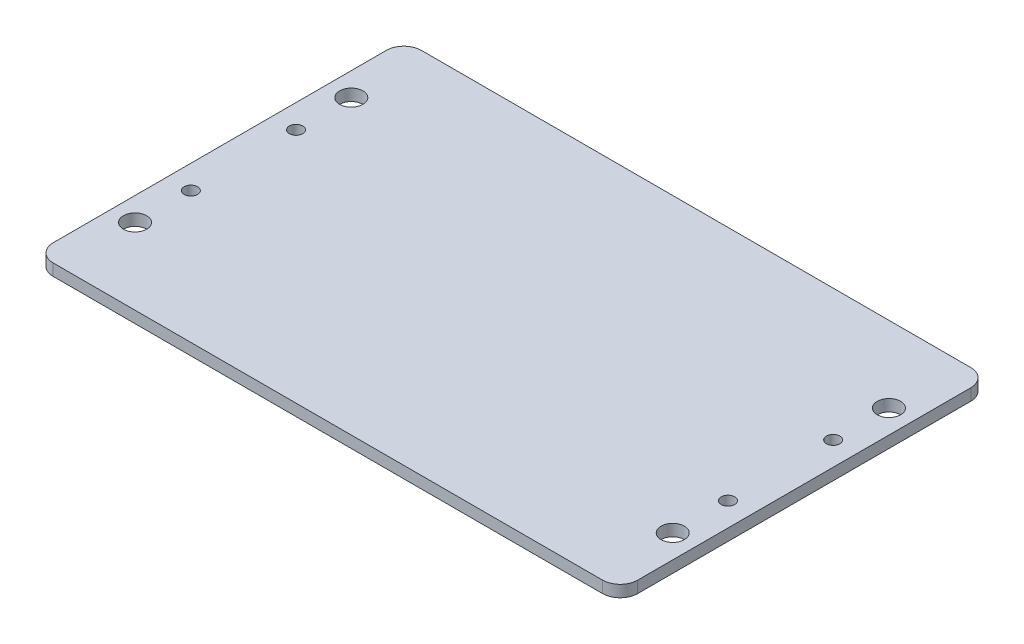
from build123d import *

# Parameters (mm, degrees)
ESBO_O1_W                = 100
ESBO_O1_H                = 63
RESSALTO_EXTRUS_O1_DEPTH = 2
ESBO_O5_R                = 2
CORTE_EXTRUS_O3_DEPTH    = 60.129096053
FILETE1_R                = 3
ESBO_O6_R                = 1.15
CORTE_EXTRUS_O4_DEPTH    = 60.129096053


with BuildPart() as part:
    # Esboço1 → Ressalto-extrusão1 (new body)
    with BuildSketch(Plane(origin=(0, 0, 0), x_dir=(1, 0, 0), z_dir=(0, 1, 0))):
        Rectangle(ESBO_O1_W, ESBO_O1_H)
    extrude(amount=RESSALTO_EXTRUS_O1_DEPTH)

    # Esboço5 → Corte-extrusão3 (cut, through all)
    with BuildSketch(Plane(origin=(0, 2, 0), x_dir=(1, 0, 0), z_dir=(0, 1, 0))):
        with Locations(Location((46, 18.5, 0), (0, 0, 270))):
            Circle(ESBO_O5_R)
        with Locations(Location((46, -18.5, 0), (0, 0, 90))):
            Circle(ESBO_O5_R)
        with Locations(Location((-46, -18.5, 0), (0, 0, 270))):
            Circle(ESBO_O5_R)
        with Locations(Location((-46, 18.5, 0), (0, 0, 90))):
            Circle(ESBO_O5_R)
    extrude(amount=-CORTE_EXTRUS_O3_DEPTH, mode=Mode.SUBTRACT)

    # Filete1
    filete1_edges = [part.edges().sort_by_distance(p)[0] for p in [
        (-50, 1, -31.5),
        (50, 1, -31.5),
        (50, 1, 31.5),
        (-50, 1, 31.5),
    ]]
    fillet(filete1_edges, radius=FILETE1_R)

    # Esboço6 → Corte-extrusão4 (cut, through all)
    with BuildSketch(Plane.XZ):
        with Locations(Location((45.95, 9, 0), (0, 0, 270))):
            Circle(ESBO_O6_R)
        with Locations(Location((45.95, -9, 0), (0, 0, 90))):
            Circle(ESBO_O6_R)
        with Locations(Location((-45.95, -9, 0), (0, 0, 270))):
            Circle(ESBO_O6_R)
        with Locations(Location((-45.95, 9, 0), (0, 0, 90))):
            Circle(ESBO_O6_R)
    extrude(amount=-CORTE_EXTRUS_O4_DEPTH, mode=Mode.SUBTRACT)


solid = part.part
